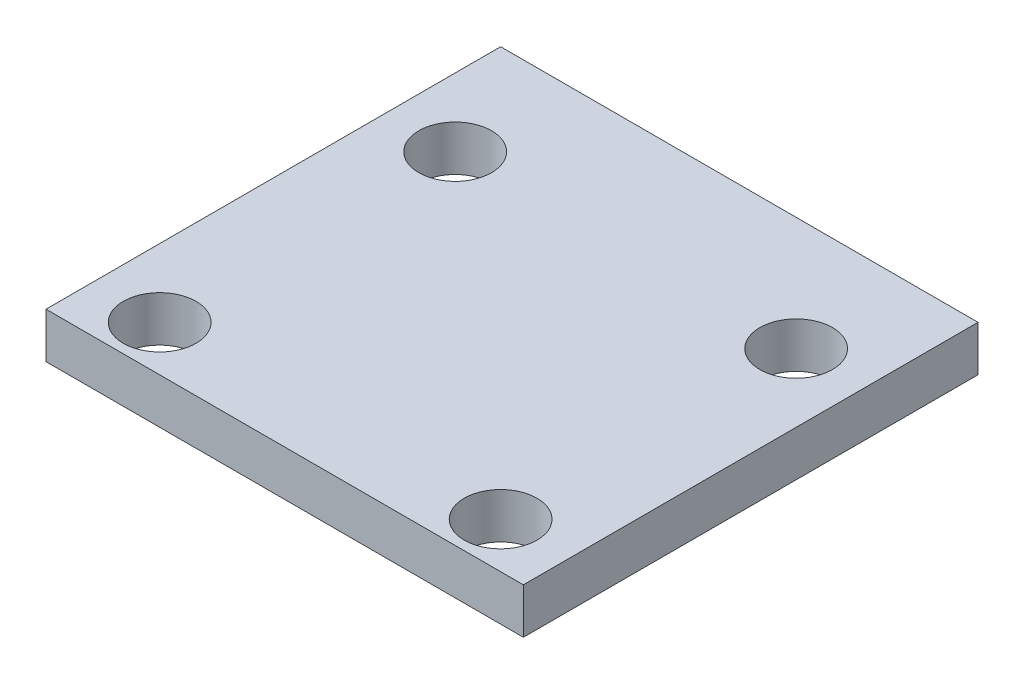
from build123d import *

# Parameters (mm, degrees)
SKETCH_1_W          = 21
SKETCH_1_H          = 20
EXTRUDE_1_DEPTH     = 2
SKETCH_2_R          = 1.6
CUT_EXTRUDE_1_DEPTH = 2


with BuildPart() as part:
    # 草图1 → 凸台-拉伸1 (new body)
    with BuildSketch(Plane(origin=(0, 0, 0), x_dir=(1, 0, 0), z_dir=(0, 1, 0))):
        Rectangle(SKETCH_1_W, SKETCH_1_H)
    extrude(amount=EXTRUDE_1_DEPTH)

    # 草图2 → 切除-拉伸1 (cut)
    with BuildSketch(Plane(origin=(0, 2, 0), x_dir=(1, 0, 0), z_dir=(0, 1, 0))):
        with Locations(Location((-7.5, 5, 0), (0, 0, 270))):
            Circle(SKETCH_2_R)
        with Locations(Location((-7.5, -8, 0), (0, 0, 270))):
            Circle(SKETCH_2_R)
        with Locations(Location((7.5, -8, 0), (0, 0, 90))):
            Circle(SKETCH_2_R)
        with Locations(Location((7.5, 5, 0), (0, 0, 90))):
            Circle(SKETCH_2_R)
    extrude(amount=-CUT_EXTRUDE_1_DEPTH, mode=Mode.SUBTRACT)


solid = part.part
